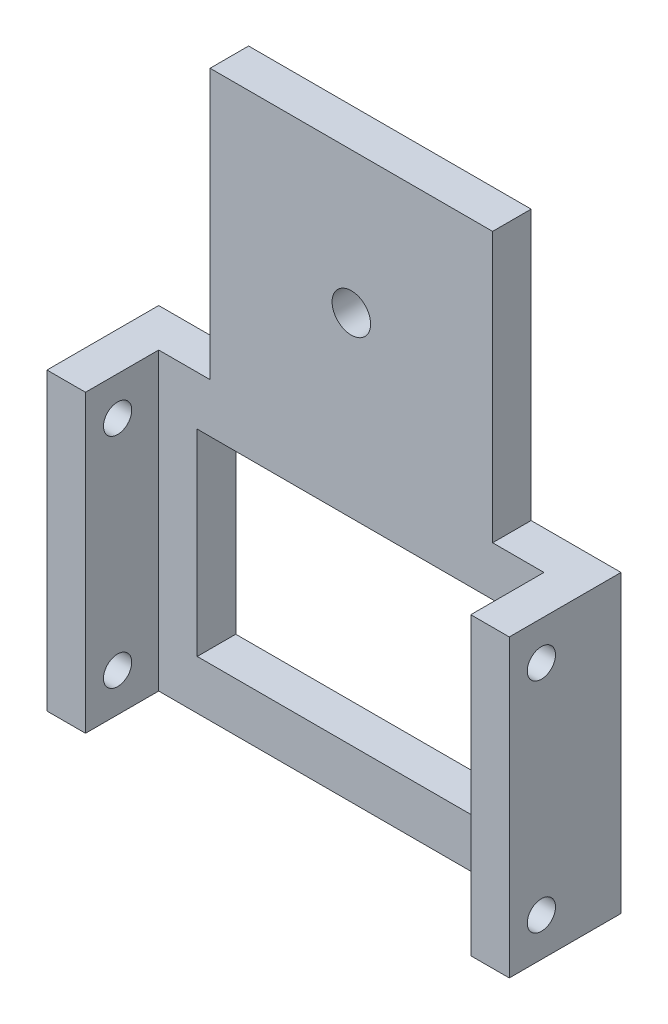
from build123d import *

# Parameters (mm, degrees)
SKETCH1_W           = 24
SKETCH1_H           = 15.333333334
SKETCH1_R           = 1.5
BOSS_EXTRUDE1_DEPTH = 3
SKETCH1_4_W         = 3
SKETCH1_4_H         = 23
BOSS_EXTRUDE2_DEPTH = 8.7
CUT_EXTRUDE1_REACH  = 51.274
SKETCH2_R           = 1.1


with BuildPart() as part:
    # Sketch1 → Boss-Extrude1 (new body)
    with BuildSketch(Plane.XY):
        Polygon((-11, 32.5), (-11, 11.5), (-15, 11.5), (-15, -11.5), (15, -11.5), (15, 11.5), (11, 11.5), (11, 32.5), align=None)
        Rectangle(SKETCH1_W, SKETCH1_H, mode=Mode.SUBTRACT)
        with Locations((0, 21.5)):
            Circle(SKETCH1_R, mode=Mode.SUBTRACT)
    extrude(amount=BOSS_EXTRUDE1_DEPTH)

    # Sketch1<4> → Boss-Extrude2 (add)
    with BuildSketch(Plane.XY):
        with Locations((16.5, 0)):
            Rectangle(SKETCH1_4_W, SKETCH1_4_H)
        with Locations((-16.5, 0)):
            Rectangle(SKETCH1_4_W, SKETCH1_4_H)
    extrude(amount=BOSS_EXTRUDE2_DEPTH)

    # Cut-Extrude1: up to this face of the body (flat: up to its plane)
    cut_extrude1_end = Plane(part.part.faces().sort_by_distance((-18, 0, 4.35))[0])
    # Sketch2 → Cut-Extrude1 (cut, up to the picked face)
    with BuildSketch(Plane(origin=(18, 0, 0), x_dir=(0, 0, -1), z_dir=(1, 0, 0)), mode=Mode.PRIVATE) as cut_extrude1_sk1:
        with Locations(Location((-6.2, 8.5, 0), (0, 0, 90))):
            Circle(SKETCH2_R)
    cut_extrude1_tool1 = split(extrude(cut_extrude1_sk1.sketch, amount=-CUT_EXTRUDE1_REACH, mode=Mode.PRIVATE), bisect_by=cut_extrude1_end, keep=Keep.BOTH, mode=Mode.PRIVATE)
    # Sketch2 → Cut-Extrude1 (cut, up to the picked face)
    with BuildSketch(Plane(origin=(18, 0, 0), x_dir=(0, 0, -1), z_dir=(1, 0, 0)), mode=Mode.PRIVATE) as cut_extrude1_sk2:
        with Locations(Location((-6.2, -8.5, 0), (0, 0, 90))):
            Circle(SKETCH2_R)
    cut_extrude1_tool2 = split(extrude(cut_extrude1_sk2.sketch, amount=-CUT_EXTRUDE1_REACH, mode=Mode.PRIVATE), bisect_by=cut_extrude1_end, keep=Keep.BOTH, mode=Mode.PRIVATE)
    add(cut_extrude1_tool1.solids().sort_by(Axis((18, 8.5, 6.2), (-1, 0, 0)))[0], mode=Mode.SUBTRACT)
    add(cut_extrude1_tool2.solids().sort_by(Axis((18, -8.5, 6.2), (-1, 0, 0)))[0], mode=Mode.SUBTRACT)


solid = part.part
